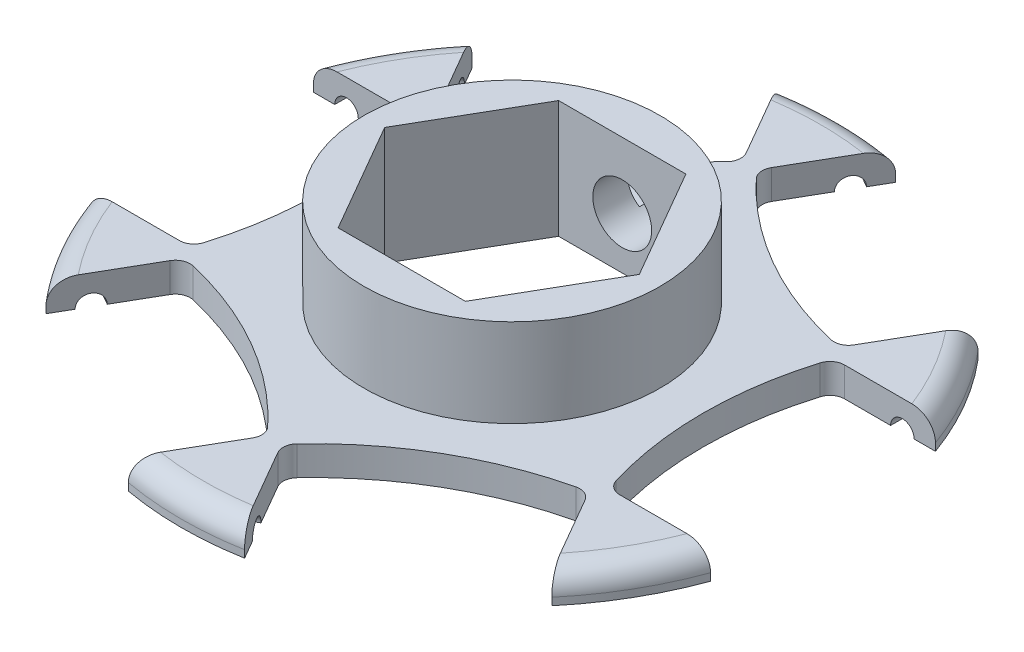
from build123d import *

# Parameters (mm, degrees)
SKIZZE1_R                       = 45
AUFSATZ_LINEAR_AUSTRAGEN1_DEPTH = 4
SCHNITT_LINEAR_START            = -10
SCHNITT_LINEAR_AUSTRAGEN2_DEPTH = 10
KREISMUSTER1_COUNT              = 6
SKIZZE4_R                       = 20.15
AUFSATZ_LINEAR_AUSTRAGEN2_DEPTH = 12
SCHNITT_LINEAR_AUSTRAGEN3_DEPTH = 16
VERRUNDUNG1_R                   = 2
SKIZZE5_R                       = 1.6
SCHNITT_LINEAR_AUSTRAGEN5_DEPTH = 3.8
VERRUNDUNG3_R                   = 0.5
KREISMUSTER2_COUNT              = 6
VERRUNDUNG3_OF_KREISMUSTER2_R   = 0.5
SCHNITT_LINEAR_START_2          = -3.8
SKIZZE6_R                       = 1.6
SCHNITT_LINEAR_AUSTRAGEN6_DEPTH = 3.8
VERRUNDUNG4_R                   = 0.5
KREISMUSTER3_COUNT              = 6
VERRUNDUNG4_OF_KREISMUSTER3_R   = 0.5
VERRUNDUNG2_R                   = 3
SKIZZE7_R                       = 4
SCHNITT_LINEAR_AUSTRAGEN7_DEPTH = 10


with BuildPart() as part:
    # Skizze1 → Aufsatz-Linear austragen1 (new body)
    with BuildSketch(Plane(origin=(0, 0, 0), x_dir=(1, 0, 0), z_dir=(0, 1, 0))):
        with Locations(Location((0, 0, 0), (0, 0, 270))):
            Circle(SKIZZE1_R)
    extrude(amount=AUFSATZ_LINEAR_AUSTRAGEN1_DEPTH)

    # Skizze2 → Schnitt-Linear austragen2 (cut)
    with BuildSketch(Plane(origin=(0, 4, 0), x_dir=(1, 0, 0), z_dir=(0, 1, 0)).offset(SCHNITT_LINEAR_START)):
        with BuildLine():
            ThreePointArc((-26, 0), (-26.63006939, 7.751752964), (-28.503736417, 15.3))
            Line((-28.503736417, 15.3), (-42.319144604, 15.3))
            ThreePointArc((-42.319144604, 15.3), (-45, 0), (-42.319144604, -15.3))
            Line((-42.319144604, -15.3), (-28.503736417, -15.3))
            ThreePointArc((-28.503736417, -15.3), (-26.63006939, -7.751752964), (-26, 0))
        make_face()
    schnitt_linear_austragen2 = extrude(amount=SCHNITT_LINEAR_AUSTRAGEN2_DEPTH, mode=Mode.SUBTRACT)

    # Kreismuster1: Schnitt-Linear austragen2 ×6 about axis
    kreismuster1_axis = Axis((0, 0, 0), (0, 1, 0))
    for i in range(1, KREISMUSTER1_COUNT):
        add(schnitt_linear_austragen2.rotate(kreismuster1_axis, i * 360 / KREISMUSTER1_COUNT), mode=Mode.SUBTRACT)

    # Skizze4 → Aufsatz-Linear austragen2 (add)
    with BuildSketch(Plane(origin=(0, 4, 0), x_dir=(1, 0, 0), z_dir=(0, 1, 0))):
        with Locations(Location((0, 0, 0), (0, 0, 270))):
            Circle(SKIZZE4_R)
    extrude(amount=AUFSATZ_LINEAR_AUSTRAGEN2_DEPTH)

    # Skizze3 → Schnitt-Linear austragen3 (cut)
    with BuildSketch(Plane.XZ):
        Polygon((17.320508076, 0), (8.660254038, 15), (-8.660254038, 15), (-17.320508076, 0), (-8.660254038, -15), (8.660254038, -15), align=None)
    extrude(amount=-SCHNITT_LINEAR_AUSTRAGEN3_DEPTH, mode=Mode.SUBTRACT)

    # Verrundung1
    verrundung1_edges = [part.edges().sort_by_distance(p)[0] for p in [
        (-28.503736417, 2, 15.3),
        (-28.503736417, 2, -15.3),
        (-27.502056886, 2, -17.03495984),
        (-1.001679531, 2, -32.33495984),
        (1.001679531, 2, -32.33495984),
        (27.502056886, 2, -17.03495984),
        (28.503736417, 2, -15.3),
        (28.503736417, 2, 15.3),
        (27.502056886, 2, 17.03495984),
        (1.001679531, 2, 32.33495984),
        (-1.001679531, 2, 32.33495984),
        (-27.502056886, 2, 17.03495984),
    ]]
    fillet(verrundung1_edges, radius=VERRUNDUNG1_R)

    # Skizze5 → Schnitt-Linear austragen5 (cut)
    with BuildSketch(Plane(origin=(13.250188678, 0, 7.65), x_dir=(-0.4999999999999918, 0, 0.8660254037844434), z_dir=(-0.8660254037844434, 0, -0.4999999999999918))):
        with Locations((-37.819144604, 0)):
            Circle(SKIZZE5_R)
    schnitt_linear_austragen5 = extrude(amount=-SCHNITT_LINEAR_AUSTRAGEN5_DEPTH, mode=Mode.SUBTRACT)

    # Verrundung3
    verrundung3_edges = [part.edges().sort_by_distance(p)[0] for p in [
        (35.450657514, 1.6, -23.202339976),
    ]]
    fillet(verrundung3_edges, radius=VERRUNDUNG3_R)

    # Kreismuster2: Schnitt-Linear austragen5 ×6 about axis
    kreismuster2_axis = Axis((0, 0, 0), (0, 1, 0))
    for i in range(1, KREISMUSTER2_COUNT):
        add(schnitt_linear_austragen5.rotate(kreismuster2_axis, i * 360 / KREISMUSTER2_COUNT), mode=Mode.SUBTRACT)

    # Verrundung3 of Kreismuster2
    verrundung3_of_kreismuster2_edges = [part.edges().sort_by_distance(p)[0] for p in [
        (-2.36848709, 1.6, -42.302339976),
        (-37.819144604, 1.6, -19.1),
        (-35.450657514, 1.6, 23.202339976),
        (2.36848709, 1.6, 42.302339976),
        (37.819144604, 1.6, 19.1),
    ]]
    fillet(verrundung3_of_kreismuster2_edges, radius=VERRUNDUNG3_OF_KREISMUSTER2_R)

    # Skizze6 → Schnitt-Linear austragen6 (cut)
    with BuildSketch(Plane.XY.offset(-15.3).offset(SCHNITT_LINEAR_START_2)):
        with Locations((37.819144604, 0)):
            Circle(SKIZZE6_R)
    schnitt_linear_austragen6 = extrude(amount=SCHNITT_LINEAR_AUSTRAGEN6_DEPTH, mode=Mode.SUBTRACT)

    # Verrundung4
    verrundung4_edges = [part.edges().sort_by_distance(p)[0] for p in [
        (37.819144604, 1.6, -19.1),
    ]]
    fillet(verrundung4_edges, radius=VERRUNDUNG4_R)

    # Kreismuster3: Schnitt-Linear austragen6 ×6 about axis
    kreismuster3_axis = Axis((0, 0, 0), (0, 1, 0))
    for i in range(1, KREISMUSTER3_COUNT):
        add(schnitt_linear_austragen6.rotate(kreismuster3_axis, i * 360 / KREISMUSTER3_COUNT), mode=Mode.SUBTRACT)

    # Verrundung4 of Kreismuster3
    verrundung4_of_kreismuster3_edges = [part.edges().sort_by_distance(p)[0] for p in [
        (2.36848709, 1.6, -42.302339976),
        (-35.450657514, 1.6, -23.202339976),
        (-37.819144604, 1.6, 19.1),
        (-2.36848709, 1.6, 42.302339976),
        (35.450657514, 1.6, 23.202339976),
    ]]
    fillet(verrundung4_of_kreismuster3_edges, radius=VERRUNDUNG4_OF_KREISMUSTER3_R)

    # Verrundung2
    verrundung2_edges = [part.edges().sort_by_distance(p)[0] for p in [
        (0, 4, 45),
        (38.97114317, 4, 22.5),
        (38.97114317, 4, -22.5),
        (0, 4, -45),
        (-38.97114317, 4, -22.5),
        (-38.97114317, 4, 22.5),
    ]]
    fillet(verrundung2_edges, radius=VERRUNDUNG2_R)

    # Skizze7 → Schnitt-Linear austragen7 (cut)
    with BuildSketch(Plane.XY.offset(-15)):
        with Locations((0, 7)):
            Circle(SKIZZE7_R)
    extrude(amount=-SCHNITT_LINEAR_AUSTRAGEN7_DEPTH, mode=Mode.SUBTRACT)


solid = part.part
